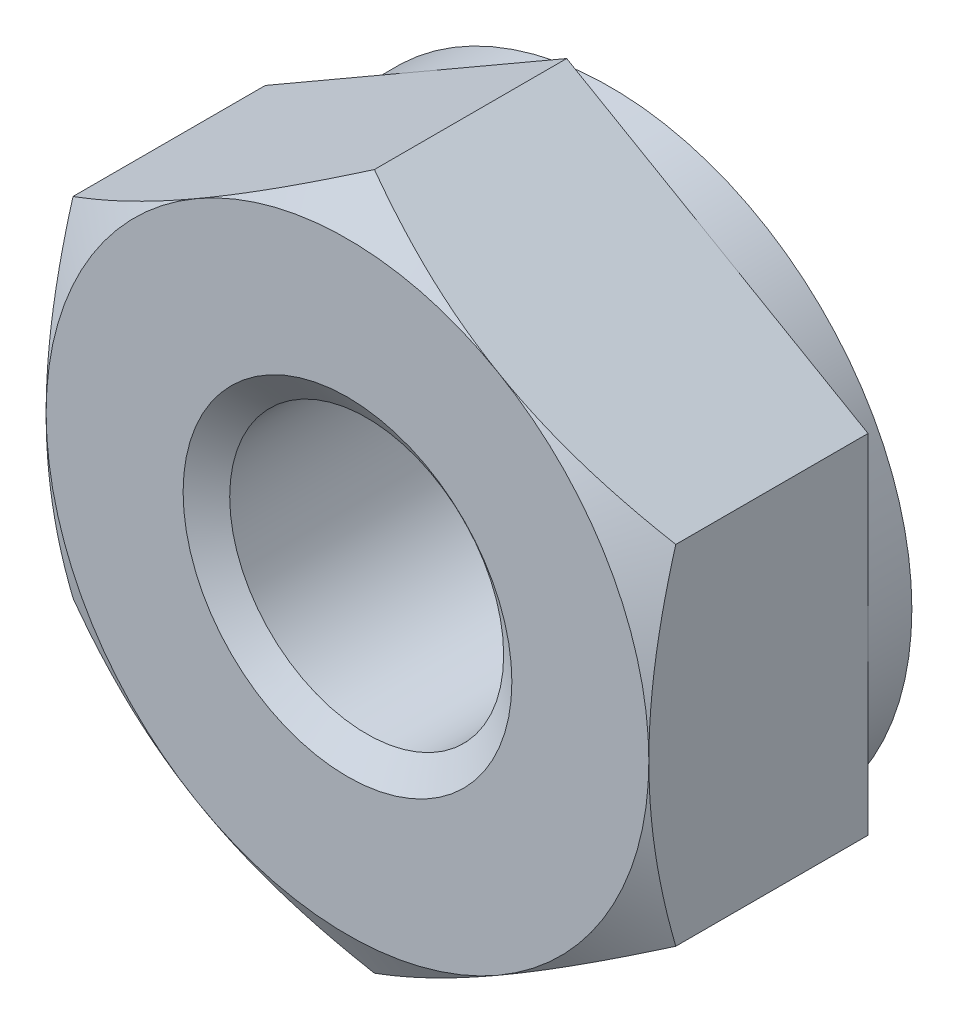
from build123d import *

# Parameters (mm, degrees)
BASENUTSKE_R  = 1.25
BASENUT_DEPTH = 2.4
SKETCH4_W     = 0.4
SKETCH4_H     = 10.425426481


with BuildPart() as part:
    # BaseNutSke → BaseNut (new body)
    with BuildSketch(Plane.XY):
        Polygon((2.75, 1.58771324), (2.75, -1.58771324), (0, -3.175426481), (-2.75, -1.58771324), (-2.75, 1.58771324), (0, 3.175426481), align=None)
        Circle(BASENUTSKE_R, mode=Mode.SUBTRACT)
    extrude(amount=-BASENUT_DEPTH)

    # Sketch4 → Bearing-Face (revolve, cut)
    with BuildSketch(Plane(origin=(0, 0, 0), x_dir=(0, 0, -1), z_dir=(1, 0, 0)), mode=Mode.PRIVATE) as bearing_face_sk:
        with Locations((2.2, 7.962713241)):
            Rectangle(SKETCH4_W, SKETCH4_H)
        Polygon((0, 2.75), (-10, 2.75), (-10, 13.175426481), (0.245620093, 13.175426481), (0.245620093, 3.175426481), align=None)
    revolve(bearing_face_sk.sketch.rotate(Axis((0, 0, 0), (0, 0, -1)), 90), axis=Axis((0, 0, 0), (0, 0, -1)), mode=Mode.SUBTRACT)

    # Sketch5 → EndChamfer (revolve, cut)
    with BuildSketch(Plane(origin=(0, 0, 0), x_dir=(0, 0, -1), z_dir=(1, 0, 0)), mode=Mode.PRIVATE) as endchamfer_sk:
        Polygon((2.3746, 1.5), (2.182042927, 1.225), (2.4254, 1.225), (2.4254, 1.5), align=None)
        Polygon((-0.0508, 1.5), (0, 1.5), (0.192557073, 1.225), (-0.0508, 1.225), align=None)
    revolve(endchamfer_sk.sketch.rotate(Axis((0, 0, -25.037505729), (0, 0, -1)), 90), axis=Axis((0, 0, -25.037505729), (0, 0, -1)), mode=Mode.SUBTRACT)


solid = part.part
